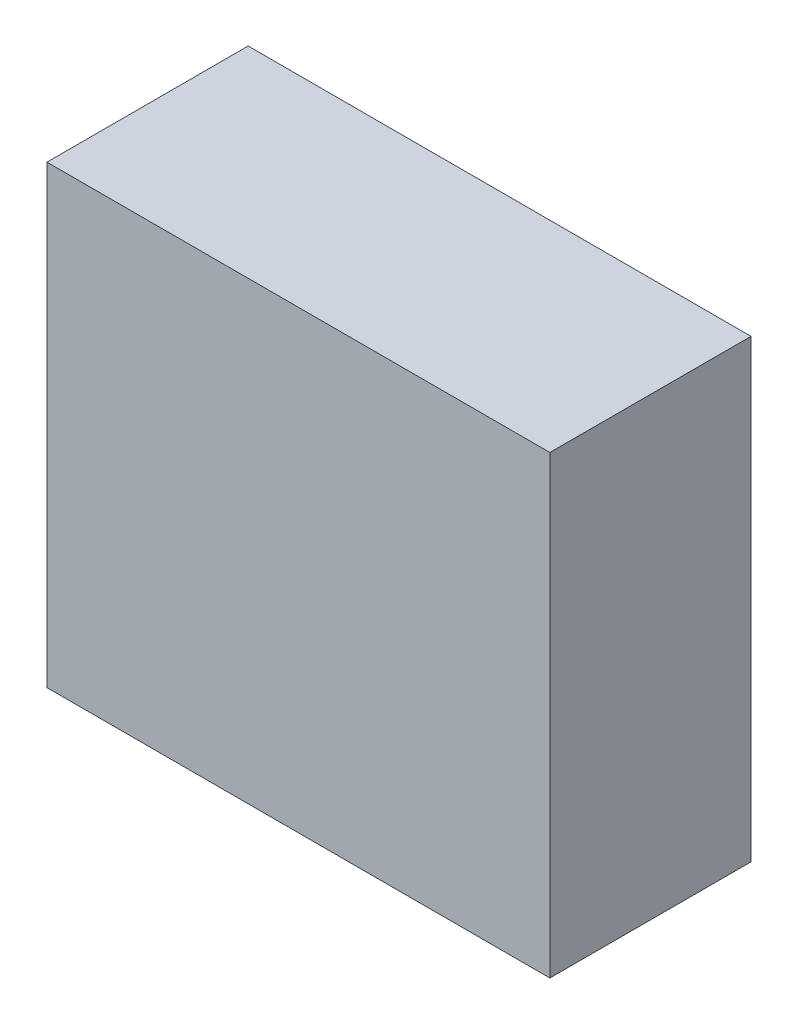
from build123d import *

# Parameters (mm, degrees)
SKETCH1_W           = 20
SKETCH1_H           = 18.1
BOSS_EXTRUDE1_DEPTH = 8


with BuildPart() as part:
    # Sketch1 → Boss-Extrude1 (new body)
    with BuildSketch(Plane.XY):
        with Locations((-2.633061224, -1.883877551)):
            Rectangle(SKETCH1_W, SKETCH1_H)
    extrude(amount=BOSS_EXTRUDE1_DEPTH)


solid = part.part
